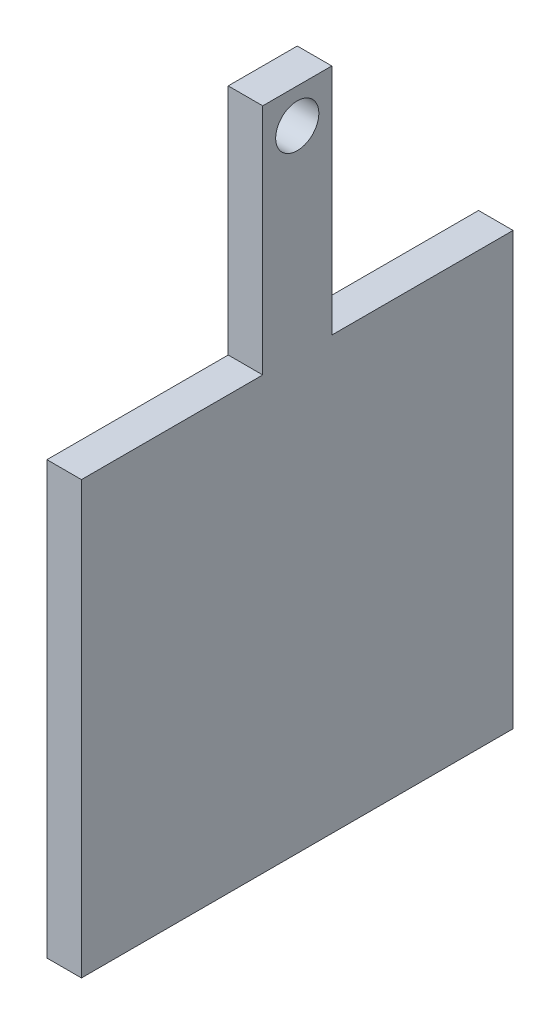
from build123d import *

# Parameters (mm, degrees)
SKETCH1_R           = 2.5
BOSS_EXTRUDE1_DEPTH = 4


with BuildPart() as part:
    # Sketch1 → Boss-Extrude1 (new body)
    with BuildSketch(Plane(origin=(0, 0, 0), x_dir=(0, 0, -1), z_dir=(1, 0, 0))):
        Polygon((0, 0), (0, 27), (8, 27), (8, 0), (29, 0), (29, -50), (-21, -50), (-21, 0), align=None)
        with Locations((4, 23)):
            Circle(SKETCH1_R, mode=Mode.SUBTRACT)
    extrude(amount=BOSS_EXTRUDE1_DEPTH)


solid = part.part
